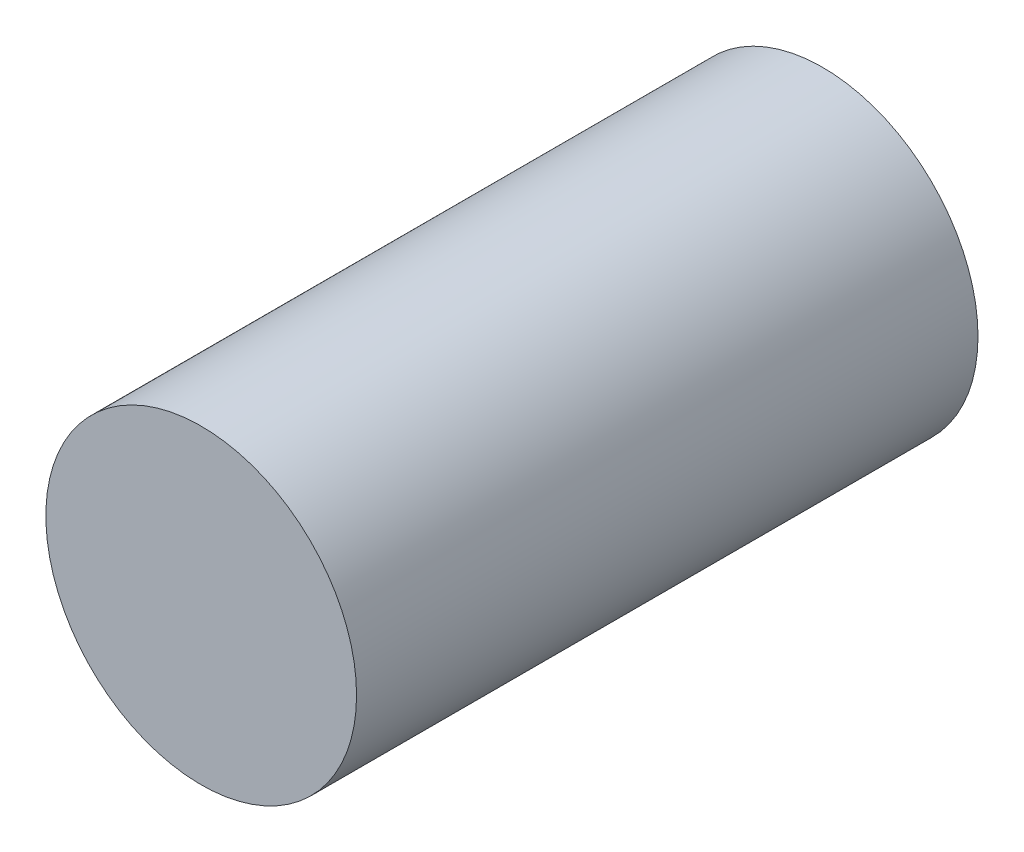
from build123d import *

# Parameters (mm, degrees)
SKETCH1_R           = 12.5
BOSS_EXTRUDE1_DEPTH = 50


with BuildPart() as part:
    # Sketch1 → Boss-Extrude1 (new body)
    with BuildSketch(Plane.XY):
        Circle(SKETCH1_R)
    extrude(amount=-BOSS_EXTRUDE1_DEPTH)


solid = part.part
